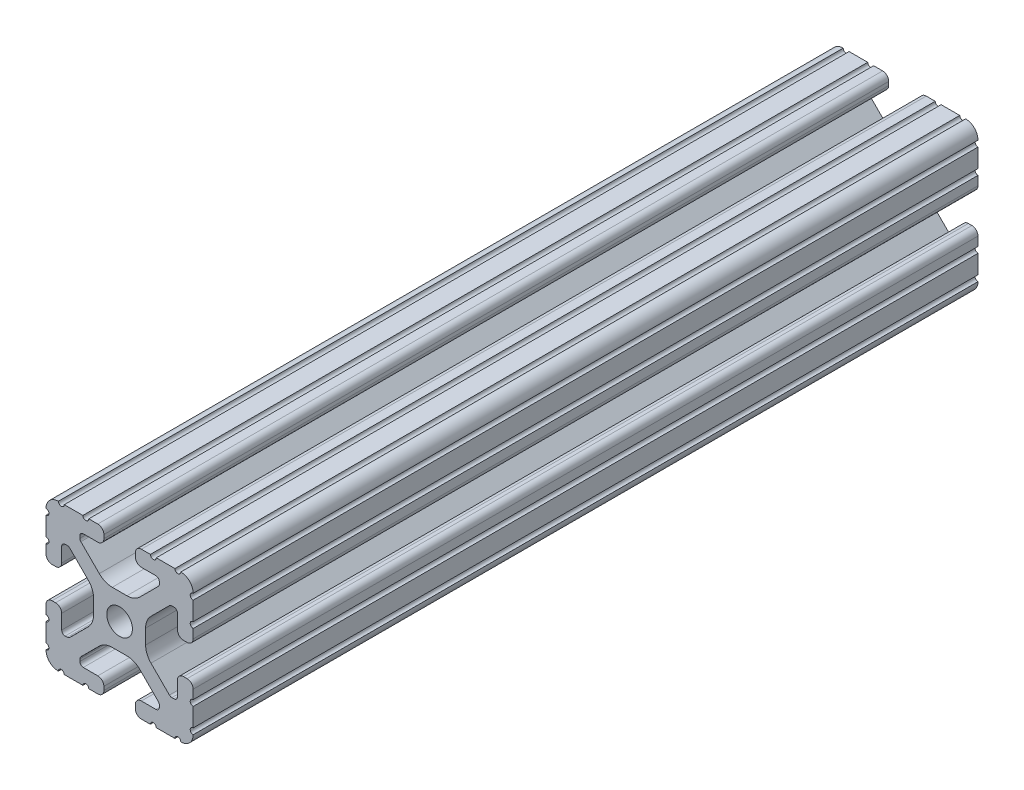
from build123d import *

# Parameters (mm, degrees)
SKETCH1_R           = 3.3274
BOSS_EXTRUDE1_DEPTH = 203.2


with BuildPart() as part:
    # Sketch1 → Boss-Extrude1 (new body)
    with BuildSketch(Plane.XY):
        with BuildLine():
            Line((-14.097, 10.287), (-13.528918, 10.287))
            ThreePointArc((-13.528918, 10.287), (-13.188712428, 10.219328904), (-12.900300071, 10.026617928))
            Line((-12.900300071, 10.026617928), (-8.129198975, 5.255516832))
            ThreePointArc((-8.129198975, 5.255516832), (-7.09957176, 3.71457081), (-6.738014764, 1.896901043))
            Line((-6.738014764, 1.896901043), (-6.738014764, -1.896901043))
            ThreePointArc((-6.738014764, -1.896901043), (-7.09957176, -3.71457081), (-8.129198975, -5.255516832))
            Line((-8.129198975, -5.255516832), (-12.900300071, -10.026617928))
            ThreePointArc((-12.900300071, -10.026617928), (-13.188712428, -10.219328904), (-13.528918, -10.287))
            Line((-13.528918, -10.287), (-14.097, -10.287))
            ThreePointArc((-14.097, -10.287), (-14.725617928, -10.026617928), (-14.986, -9.398))
            Line((-14.986, -9.398), (-14.986, -5.6388))
            ThreePointArc((-14.986, -5.6388), (-15.447248241, -4.525248241), (-16.5608, -4.064))
            Line((-16.5608, -4.064), (-17.4752, -4.064))
            ThreePointArc((-17.4752, -4.064), (-18.588751759, -4.525248241), (-19.05, -5.6388))
            Line((-19.05, -5.6388), (-19.05, -7.9756))
            ThreePointArc((-19.05, -7.9756), (-18.288, -8.7376), (-19.05, -9.4996))
            Line((-19.05, -9.4996), (-19.05, -14.3256))
            ThreePointArc((-19.05, -14.3256), (-18.288, -15.0876), (-19.05, -15.8496))
            Line((-19.05, -15.8496), (-19.05, -15.875))
            ThreePointArc((-19.05, -15.875), (-18.12006403, -18.12006403), (-15.875, -19.05))
            Line((-15.875, -19.05), (-15.8496, -19.05))
            ThreePointArc((-15.8496, -19.05), (-15.0876, -18.288), (-14.3256, -19.05))
            Line((-14.3256, -19.05), (-9.4996, -19.05))
            ThreePointArc((-9.4996, -19.05), (-8.7376, -18.288), (-7.9756, -19.05))
            Line((-7.9756, -19.05), (-5.6388, -19.05))
            ThreePointArc((-5.6388, -19.05), (-4.525248241, -18.588751759), (-4.064, -17.4752))
            Line((-4.064, -17.4752), (-4.064, -16.5608))
            ThreePointArc((-4.064, -16.5608), (-4.525248241, -15.447248241), (-5.6388, -14.986))
            Line((-5.6388, -14.986), (-9.398, -14.986))
            ThreePointArc((-9.398, -14.986), (-10.026617928, -14.725617928), (-10.287, -14.097))
            Line((-10.287, -14.097), (-10.287, -13.528918))
            ThreePointArc((-10.287, -13.528918), (-10.219328904, -13.188712428), (-10.026617928, -12.900300071))
            Line((-10.026617928, -12.900300071), (-5.255516832, -8.129198975))
            ThreePointArc((-5.255516832, -8.129198975), (-3.71457081, -7.09957176), (-1.896901043, -6.738014764))
            Line((-1.896901043, -6.738014764), (1.896901043, -6.738014764))
            ThreePointArc((1.896901043, -6.738014764), (3.71457081, -7.09957176), (5.255516832, -8.129198975))
            Line((5.255516832, -8.129198975), (10.026617928, -12.900300071))
            ThreePointArc((10.026617928, -12.900300071), (10.219328904, -13.188712428), (10.287, -13.528918))
            Line((10.287, -13.528918), (10.287, -14.097))
            ThreePointArc((10.287, -14.097), (10.026617928, -14.725617928), (9.398, -14.986))
            Line((9.398, -14.986), (5.6388, -14.986))
            ThreePointArc((5.6388, -14.986), (4.525248241, -15.447248241), (4.064, -16.5608))
            Line((4.064, -16.5608), (4.064, -17.4752))
            ThreePointArc((4.064, -17.4752), (4.525248241, -18.588751759), (5.6388, -19.05))
            Line((5.6388, -19.05), (7.9756, -19.05))
            ThreePointArc((7.9756, -19.05), (8.7376, -18.288), (9.4996, -19.05))
            Line((9.4996, -19.05), (14.3256, -19.05))
            ThreePointArc((14.3256, -19.05), (15.0876, -18.288), (15.8496, -19.05))
            Line((15.8496, -19.05), (15.875, -19.05))
            ThreePointArc((15.875, -19.05), (18.12006403, -18.12006403), (19.05, -15.875))
            Line((19.05, -15.875), (19.05, -15.8496))
            ThreePointArc((19.05, -15.8496), (18.288, -15.0876), (19.05, -14.3256))
            Line((19.05, -14.3256), (19.05, -9.4996))
            ThreePointArc((19.05, -9.4996), (18.288, -8.7376), (19.05, -7.9756))
            Line((19.05, -7.9756), (19.05, -5.6388))
            ThreePointArc((19.05, -5.6388), (18.588751759, -4.525248241), (17.4752, -4.064))
            Line((17.4752, -4.064), (16.5608, -4.064))
            ThreePointArc((16.5608, -4.064), (15.447248241, -4.525248241), (14.986, -5.6388))
            Line((14.986, -5.6388), (14.986, -9.398))
            ThreePointArc((14.986, -9.398), (14.725617928, -10.026617928), (14.097, -10.287))
            Line((14.097, -10.287), (13.528918, -10.287))
            ThreePointArc((13.528918, -10.287), (13.188712428, -10.219328904), (12.900300071, -10.026617928))
            Line((12.900300071, -10.026617928), (8.129198975, -5.255516832))
            ThreePointArc((8.129198975, -5.255516832), (7.09957176, -3.71457081), (6.738014764, -1.896901043))
            Line((6.738014764, -1.896901043), (6.738014764, 1.896901043))
            ThreePointArc((6.738014764, 1.896901043), (7.09957176, 3.71457081), (8.129198975, 5.255516832))
            Line((8.129198975, 5.255516832), (12.900300071, 10.026617928))
            ThreePointArc((12.900300071, 10.026617928), (13.188712428, 10.219328904), (13.528918, 10.287))
            Line((13.528918, 10.287), (14.097, 10.287))
            ThreePointArc((14.097, 10.287), (14.725617928, 10.026617928), (14.986, 9.398))
            Line((14.986, 9.398), (14.986, 5.6388))
            ThreePointArc((14.986, 5.6388), (15.447248241, 4.525248241), (16.5608, 4.064))
            Line((16.5608, 4.064), (17.4752, 4.064))
            ThreePointArc((17.4752, 4.064), (18.588751759, 4.525248241), (19.05, 5.6388))
            Line((19.05, 5.6388), (19.05, 7.9756))
            ThreePointArc((19.05, 7.9756), (18.288, 8.7376), (19.05, 9.4996))
            Line((19.05, 9.4996), (19.05, 14.3256))
            ThreePointArc((19.05, 14.3256), (18.288, 15.0876), (19.05, 15.8496))
            Line((19.05, 15.8496), (19.05, 15.875))
            ThreePointArc((19.05, 15.875), (18.12006403, 18.12006403), (15.875, 19.05))
            Line((15.875, 19.05), (15.8496, 19.05))
            ThreePointArc((15.8496, 19.05), (15.0876, 18.288), (14.3256, 19.05))
            Line((14.3256, 19.05), (9.4996, 19.05))
            ThreePointArc((9.4996, 19.05), (8.7376, 18.288), (7.9756, 19.05))
            Line((7.9756, 19.05), (5.6388, 19.05))
            ThreePointArc((5.6388, 19.05), (4.525248241, 18.588751759), (4.064, 17.4752))
            Line((4.064, 17.4752), (4.064, 16.5608))
            ThreePointArc((4.064, 16.5608), (4.525248241, 15.447248241), (5.6388, 14.986))
            Line((5.6388, 14.986), (9.398, 14.986))
            ThreePointArc((9.398, 14.986), (10.026617928, 14.725617928), (10.287, 14.097))
            Line((10.287, 14.097), (10.287, 13.528918))
            ThreePointArc((10.287, 13.528918), (10.219328904, 13.188712428), (10.026617928, 12.900300071))
            Line((10.026617928, 12.900300071), (5.255516832, 8.129198975))
            ThreePointArc((5.255516832, 8.129198975), (3.71457081, 7.09957176), (1.896901043, 6.738014764))
            Line((1.896901043, 6.738014764), (-1.896901043, 6.738014764))
            ThreePointArc((-1.896901043, 6.738014764), (-3.71457081, 7.09957176), (-5.255516832, 8.129198975))
            Line((-5.255516832, 8.129198975), (-10.026617928, 12.900300071))
            ThreePointArc((-10.026617928, 12.900300071), (-10.219328904, 13.188712428), (-10.287, 13.528918))
            Line((-10.287, 13.528918), (-10.287, 14.097))
            ThreePointArc((-10.287, 14.097), (-10.026617928, 14.725617928), (-9.398, 14.986))
            Line((-9.398, 14.986), (-5.6388, 14.986))
            ThreePointArc((-5.6388, 14.986), (-4.525248241, 15.447248241), (-4.064, 16.5608))
            Line((-4.064, 16.5608), (-4.064, 17.4752))
            ThreePointArc((-4.064, 17.4752), (-4.525248241, 18.588751759), (-5.6388, 19.05))
            Line((-5.6388, 19.05), (-7.9756, 19.05))
            ThreePointArc((-7.9756, 19.05), (-8.7376, 18.288), (-9.4996, 19.05))
            Line((-9.4996, 19.05), (-14.3256, 19.05))
            ThreePointArc((-14.3256, 19.05), (-15.0876, 18.288), (-15.8496, 19.05))
            Line((-15.8496, 19.05), (-15.875, 19.05))
            ThreePointArc((-15.875, 19.05), (-18.12006403, 18.12006403), (-19.05, 15.875))
            Line((-19.05, 15.875), (-19.05, 15.8496))
            ThreePointArc((-19.05, 15.8496), (-18.288, 15.0876), (-19.05, 14.3256))
            Line((-19.05, 14.3256), (-19.05, 9.4996))
            ThreePointArc((-19.05, 9.4996), (-18.288, 8.7376), (-19.05, 7.9756))
            Line((-19.05, 7.9756), (-19.05, 5.6388))
            ThreePointArc((-19.05, 5.6388), (-18.588751759, 4.525248241), (-17.4752, 4.064))
            Line((-17.4752, 4.064), (-16.5608, 4.064))
            ThreePointArc((-16.5608, 4.064), (-15.447248241, 4.525248241), (-14.986, 5.6388))
            Line((-14.986, 5.6388), (-14.986, 9.398))
            ThreePointArc((-14.986, 9.398), (-14.725617928, 10.026617928), (-14.097, 10.287))
        make_face()
        Circle(SKETCH1_R, mode=Mode.SUBTRACT)
    extrude(amount=BOSS_EXTRUDE1_DEPTH)


solid = part.part
